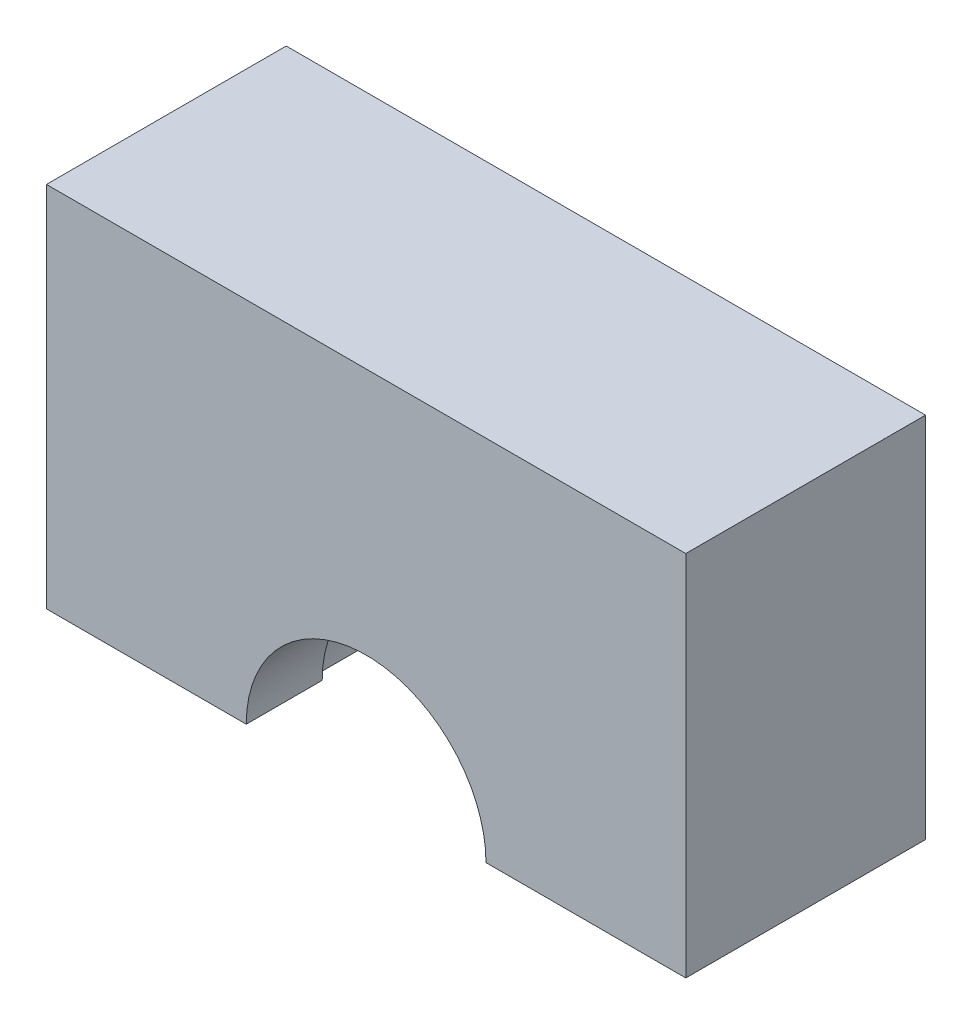
from build123d import *

# Parameters (mm, degrees)
BOSS_EXTRUDE1_DEPTH = 15
SKETCH2_W           = 5.5
SKETCH2_H           = 1.517546376


with BuildPart() as part:
    # Sketch1 → Boss-Extrude1 (new body)
    with BuildSketch(Plane.XY):
        with BuildLine():
            Line((-20, 0), (-20, 23))
            Line((-20, 23), (20, 23))
            Line((20, 23), (20, 0))
            Line((20, 0), (7.5, 0))
            ThreePointArc((7.5, 0), (0, 7.5), (-7.5, 0))
            Line((-7.5, 0), (-20, 0))
        make_face()
    extrude(amount=BOSS_EXTRUDE1_DEPTH)

    # Sketch2 → Cut-Revolve2 (revolve, cut)
    with BuildSketch(Plane(origin=(0, 0, 0), x_dir=(0, 0, -1), z_dir=(1, 0, 0))):
        with Locations((-7.5, 7.241226812)):
            Rectangle(SKETCH2_W, SKETCH2_H)
    revolve(axis=Axis((0, 0, 0), (0, 0, 1)), mode=Mode.SUBTRACT)


solid = part.part
